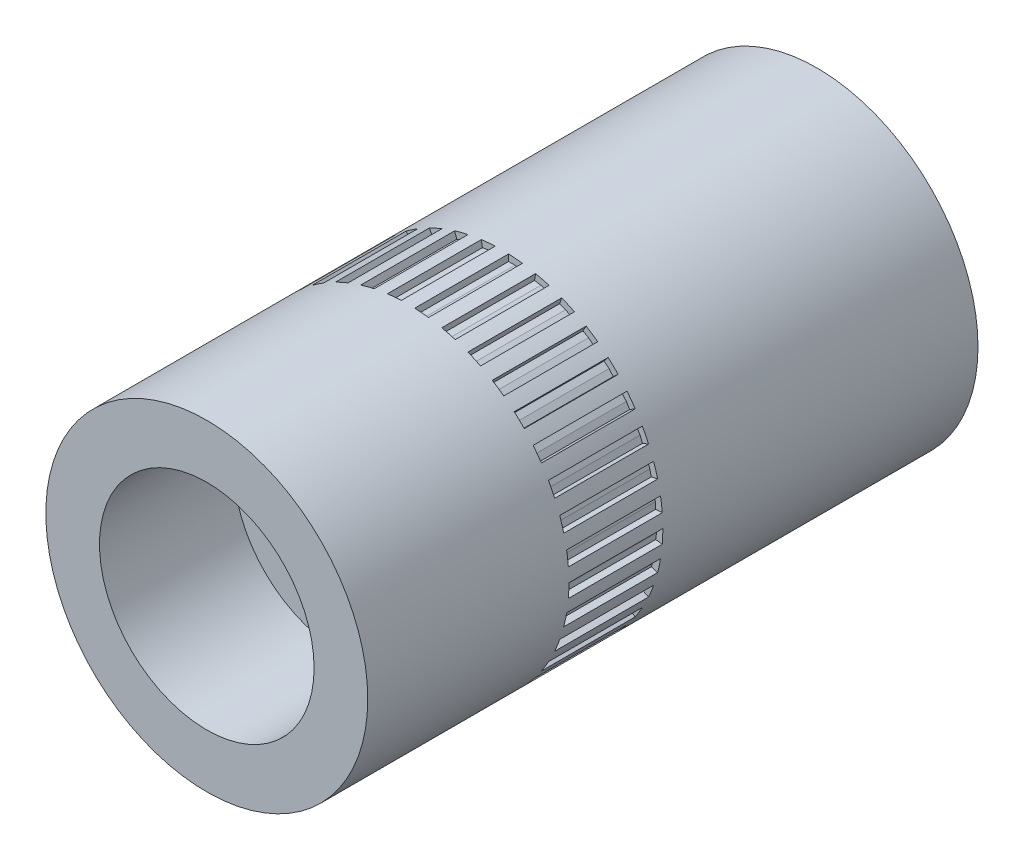
from build123d import *

# Parameters (mm, degrees)
IZIM1_R                     = 11
IZIM1_R_2                   = 9.1
Y_KSEKLIK_EKSTR_ZYON1_DEPTH = 26.5
Y_KSEKLIK_EKSTR_ZYON2_START = -30.5
IZIM2_R                     = 12
IZIM2_R_2                   = 11
Y_KSEKLIK_EKSTR_ZYON2_DEPTH = 30.5
KES_EKSTR_ZYON1_START       = -7
KES_EKSTR_ZYON1_DEPTH       = 7
IZIM4_R                     = 12
Y_KSEKLIK_EKSTR_ZYON3_DEPTH = 5
IZIM5_R                     = 12
IZIM5_R_2                   = 8
Y_KSEKLIK_EKSTR_ZYON4_DEPTH = 10


with BuildPart() as part:
    # Çizim1 → Yükseklik-Ekstrüzyon1 (new body)
    with BuildSketch(Plane.XY):
        Circle(IZIM1_R)
        Circle(IZIM1_R_2, mode=Mode.SUBTRACT)
    extrude(amount=Y_KSEKLIK_EKSTR_ZYON1_DEPTH)

    # Çizim2 → Yükseklik-Ekstrüzyon2 (add)
    with BuildSketch(Plane.XY.offset(26.5).offset(Y_KSEKLIK_EKSTR_ZYON2_START)):
        Circle(IZIM2_R)
        Circle(IZIM2_R_2, mode=Mode.SUBTRACT)
    extrude(amount=Y_KSEKLIK_EKSTR_ZYON2_DEPTH)

    # Çizim3 → Kes-Ekstrüzyon1 (cut)
    with BuildSketch(Plane.XY.offset(26.5).offset(KES_EKSTR_ZYON1_START)):
        with BuildLine():
            Line((-0.50016, 11.5), (-0.50016, 11.989572135))
            ThreePointArc((-0.50016, 11.989572135), (-1.017671094, 11.956769863), (-1.533281872, 11.901640505))
            Line((-1.533281872, 11.901640505), (-1.45054378, 11.419110419))
            Line((-1.45054378, 11.419110419), (-0.978794249, 11.5))
            Line((-0.978794249, 11.5), (-0.50016, 11.5))
        make_face()
        with BuildLine():
            ThreePointArc((1.533281872, 11.901640505), (1.017671094, 11.956769863), (0.50016, 11.989572135))
            Line((0.50016, 11.989572135), (0.50016, 11.5))
            Line((0.50016, 11.5), (0.978794249, 11.5))
            Line((0.978794249, 11.5), (1.45054378, 11.419110419))
            Line((1.45054378, 11.419110419), (1.533281872, 11.901640505))
        make_face()
        with BuildLine():
            Line((-2.436475087, 11.250055519), (-2.51921318, 11.732585604))
            ThreePointArc((-2.51921318, 11.732585604), (-3.023736737, 11.612795363), (-3.522614017, 11.471320346))
            Line((-3.522614017, 11.471320346), (-3.359518056, 11.009713823))
            Line((-3.359518056, 11.009713823), (-2.908224618, 11.169165938))
            Line((-2.908224618, 11.169165938), (-2.436475087, 11.250055519))
        make_face()
        with BuildLine():
            ThreePointArc((3.522614017, 11.471320346), (3.023736737, 11.612795363), (2.51921318, 11.732585604))
            Line((2.51921318, 11.732585604), (2.436475087, 11.250055519))
            Line((2.436475087, 11.250055519), (2.908224618, 11.169165938))
            Line((2.908224618, 11.169165938), (3.359518056, 11.009713823))
            Line((3.359518056, 11.009713823), (3.522614017, 11.471320346))
        make_face()
        with BuildLine():
            Line((-4.302697223, 10.676467423), (-4.465793183, 11.138073947))
            ThreePointArc((-4.465793183, 11.138073947), (-4.942814979, 10.934741885), (-5.41060697, 10.710991187))
            Line((-5.41060697, 10.710991187), (-5.171845115, 10.283587804))
            Line((-5.171845115, 10.283587804), (-4.753990661, 10.517015308))
            Line((-4.753990661, 10.517015308), (-4.302697223, 10.676467423))
        make_face()
        with BuildLine():
            ThreePointArc((5.41060697, 10.710991187), (4.942814979, 10.934741885), (4.465793183, 11.138073947))
            Line((4.465793183, 11.138073947), (4.302697223, 10.676467423))
            Line((4.302697223, 10.676467423), (4.753990661, 10.517015308))
            Line((4.753990661, 10.517015308), (5.171845115, 10.283587804))
            Line((5.171845115, 10.283587804), (5.41060697, 10.710991187))
        make_face()
        with BuildLine():
            Line((-6.045138593, 9.795736798), (-6.283900447, 10.223140181))
            ThreePointArc((-6.283900447, 10.223140181), (-6.719697434, 9.942115791), (-7.142946611, 9.642526314))
            Line((-7.142946611, 9.642526314), (-6.835387606, 9.261621689))
            Line((-6.835387606, 9.261621689), (-6.462993047, 9.562309295))
            Line((-6.462993047, 9.562309295), (-6.045138593, 9.795736798))
        make_face()
        with BuildLine():
            ThreePointArc((7.142946611, 9.642526314), (6.719697434, 9.942115791), (6.283900447, 10.223140181))
            Line((6.283900447, 10.223140181), (6.045138593, 9.795736798))
            Line((6.045138593, 9.795736798), (6.462993047, 9.562309295))
            Line((6.462993047, 9.562309295), (6.835387606, 9.261621689))
            Line((6.835387606, 9.261621689), (7.142946611, 9.642526314))
        make_face()
        with BuildLine():
            Line((-7.613672332, 8.633200661), (-7.921231337, 9.014105286))
            ThreePointArc((-7.921231337, 9.014105286), (-8.303266428, 8.663473127), (-8.669796684, 8.296663514))
            Line((-8.669796684, 8.296663514), (-8.302288441, 7.973215579))
            Line((-8.302288441, 7.973215579), (-7.986066891, 8.332513054))
            Line((-7.986066891, 8.332513054), (-7.613672332, 8.633200661))
        make_face()
        with BuildLine():
            ThreePointArc((8.669796684, 8.296663514), (8.303266428, 8.663473127), (7.921231337, 9.014105286))
            Line((7.921231337, 9.014105286), (7.613672332, 8.633200661))
            Line((7.613672332, 8.633200661), (7.986066891, 8.332513054))
            Line((7.986066891, 8.332513054), (8.302288441, 7.973215579))
            Line((8.302288441, 7.973215579), (8.669796684, 8.296663514))
        make_face()
        with BuildLine():
            Line((-8.96317458, 7.222303059), (-9.330682823, 7.545750993))
            ThreePointArc((-9.330682823, 7.545750993), (-9.647965564, 7.135598116), (-9.947232491, 6.712120811))
            Line((-9.947232491, 6.712120811), (-9.530347553, 6.455434574))
            Line((-9.530347553, 6.455434574), (-9.27939613, 6.863005584))
            Line((-9.27939613, 6.863005584), (-8.96317458, 7.222303059))
        make_face()
        with BuildLine():
            ThreePointArc((9.947232491, 6.712120811), (9.647965564, 7.135598116), (9.330682823, 7.545750993))
            Line((9.330682823, 7.545750993), (8.96317458, 7.222303059))
            Line((8.96317458, 7.222303059), (9.27939613, 6.863005584))
            Line((9.27939613, 6.863005584), (9.530347553, 6.455434574))
            Line((9.530347553, 6.455434574), (9.947232491, 6.712120811))
        make_face()
        with BuildLine():
            Line((-10.054822615, 5.603632947), (-10.471707553, 5.860319183))
            ThreePointArc((-10.471707553, 5.860319183), (-10.715110298, 5.402444938), (-10.93850453, 4.934482612))
            Line((-10.93850453, 4.934482612), (-10.484235918, 4.75194247))
            Line((-10.484235918, 4.75194247), (-10.305774038, 5.196061938))
            Line((-10.305774038, 5.196061938), (-10.054822615, 5.603632947))
        make_face()
        with BuildLine():
            ThreePointArc((10.93850453, 4.934482612), (10.715110298, 5.402444938), (10.471707553, 5.860319183))
            Line((10.471707553, 5.860319183), (10.054822615, 5.603632947))
            Line((10.054822615, 5.603632947), (10.305774038, 5.196061938))
            Line((10.305774038, 5.196061938), (10.484235918, 4.75194247))
            Line((10.484235918, 4.75194247), (10.93850453, 4.934482612))
        make_face()
        with BuildLine():
            Line((-10.85721171, 3.823756519), (-11.311480322, 4.00629666))
            ThreePointArc((-11.311480322, 4.00629666), (-11.474000817, 3.513873255), (-11.615095709, 3.014888333))
            Line((-11.615095709, 3.014888333), (-11.136511904, 2.911745633))
            Line((-11.136511904, 2.911745633), (-11.03567359, 3.379637051))
            Line((-11.03567359, 3.379637051), (-10.85721171, 3.823756519))
        make_face()
        with BuildLine():
            ThreePointArc((11.615095709, 3.014888333), (11.474000817, 3.513873255), (11.311480322, 4.00629666))
            Line((11.311480322, 4.00629666), (10.85721171, 3.823756519))
            Line((10.85721171, 3.823756519), (11.03567359, 3.379637051))
            Line((11.03567359, 3.379637051), (11.136511904, 2.911745633))
            Line((11.136511904, 2.911745633), (11.615095709, 3.014888333))
        make_face()
        with BuildLine():
            Line((-11.347258592, 1.933877577), (-11.825842397, 2.037020277))
            ThreePointArc((-11.825842397, 2.037020277), (-11.902805223, 1.524213837), (-11.957541733, 1.008561206))
            Line((-11.957541733, 1.008561206), (-11.468410719, 0.987783176))
            Line((-11.468410719, 0.987783176), (-11.448096906, 1.465986159))
            Line((-11.448096906, 1.465986159), (-11.347258592, 1.933877577))
        make_face()
        with BuildLine():
            ThreePointArc((11.957541733, 1.008561206), (11.902805223, 1.524213837), (11.825842397, 2.037020277))
            Line((11.825842397, 2.037020277), (11.347258592, 1.933877577))
            Line((11.347258592, 1.933877577), (11.448096906, 1.465986159))
            Line((11.448096906, 1.465986159), (11.468410719, 0.987783176))
            Line((11.468410719, 0.987783176), (11.957541733, 1.008561206))
        make_face()
        with BuildLine():
            Line((-11.510865504, -0.011635502), (-11.999996517, 0.009142528))
            ThreePointArc((-11.999996517, 0.009142528), (-11.989187594, -0.509294438), (-11.955991052, -1.026780391))
            Line((-11.955991052, -1.026780391), (-11.470384238, -0.964596005))
            Line((-11.470384238, -0.964596005), (-11.531179317, -0.489838486))
            Line((-11.531179317, -0.489838486), (-11.510865504, -0.011635502))
        make_face()
        with BuildLine():
            ThreePointArc((11.955991052, -1.026780391), (11.989187594, -0.509294438), (11.999996517, 0.009142528))
            Line((11.999996517, 0.009142528), (11.510865504, -0.011635502))
            Line((11.510865504, -0.011635502), (11.531179317, -0.489838486))
            Line((11.531179317, -0.489838486), (11.470384238, -0.964596005))
            Line((11.470384238, -0.964596005), (11.955991052, -1.026780391))
        make_face()
        with BuildLine():
            Line((-11.343325773, -1.956813849), (-11.828932586, -2.018998234))
            ThreePointArc((-11.828932586, -2.018998234), (-11.730662867, -2.52815124), (-11.610488276, -3.032583385))
            Line((-11.610488276, -3.032583385), (-11.142375687, -2.889225516))
            Line((-11.142375687, -2.889225516), (-11.282530694, -2.431571369))
            Line((-11.282530694, -2.431571369), (-11.343325773, -1.956813849))
        make_face()
        with BuildLine():
            ThreePointArc((11.610488276, -3.032583385), (11.730662867, -2.52815124), (11.828932586, -2.018998234))
            Line((11.828932586, -2.018998234), (11.343325773, -1.956813849))
            Line((11.343325773, -1.956813849), (11.282530694, -2.431571369))
            Line((11.282530694, -2.431571369), (11.142375687, -2.889225516))
            Line((11.142375687, -2.889225516), (11.610488276, -3.032583385))
        make_face()
        with BuildLine():
            Line((-10.849459212, -3.845698224), (-11.317571802, -3.989056093))
            ThreePointArc((-11.317571802, -3.989056093), (-11.134668328, -4.474277733), (-10.930972892, -4.951144477))
            Line((-10.930972892, -4.951144477), (-10.493821274, -4.730737268))
            Line((-10.493821274, -4.730737268), (-10.709304205, -4.303352371))
            Line((-10.709304205, -4.303352371), (-10.849459212, -3.845698224))
        make_face()
        with BuildLine():
            ThreePointArc((10.930972892, -4.951144477), (11.134668328, -4.474277733), (11.317571802, -3.989056093))
            Line((11.317571802, -3.989056093), (10.849459212, -3.845698224))
            Line((10.849459212, -3.845698224), (10.709304205, -4.303352371))
            Line((10.709304205, -4.303352371), (10.493821274, -4.730737268))
            Line((10.493821274, -4.730737268), (10.930972892, -4.951144477))
        make_face()
        with BuildLine():
            Line((-10.043473464, -5.623948863), (-10.480625082, -5.844356071))
            ThreePointArc((-10.480625082, -5.844356071), (-10.218349653, -6.291687403), (-9.93699332, -6.727270156))
            Line((-9.93699332, -6.727270156), (-9.543378729, -6.436154323))
            Line((-9.543378729, -6.436154323), (-9.827990532, -6.05133376))
            Line((-9.827990532, -6.05133376), (-10.043473464, -5.623948863))
        make_face()
        with BuildLine():
            ThreePointArc((9.93699332, -6.727270156), (10.218349653, -6.291687403), (10.480625082, -5.844356071))
            Line((10.480625082, -5.844356071), (10.043473464, -5.623948863))
            Line((10.043473464, -5.623948863), (9.827990532, -6.05133376))
            Line((9.827990532, -6.05133376), (9.543378729, -6.436154323))
            Line((9.543378729, -6.436154323), (9.93699332, -6.727270156))
        make_face()
        with BuildLine():
            Line((-8.94855527, -7.240408732), (-9.342169861, -7.531524566))
            ThreePointArc((-9.342169861, -7.531524566), (-9.008067663, -7.928096681), (-8.657144542, -8.309864522))
            Line((-8.657144542, -8.309864522), (-8.318390553, -7.956414936))
            Line((-8.318390553, -7.956414936), (-8.663943466, -7.625229295))
            Line((-8.663943466, -7.625229295), (-8.94855527, -7.240408732))
        make_face()
        with BuildLine():
            ThreePointArc((8.657144542, -8.309864522), (9.008067663, -7.928096681), (9.342169861, -7.531524566))
            Line((9.342169861, -7.531524566), (8.94855527, -7.240408732))
            Line((8.94855527, -7.240408732), (8.663943466, -7.625229295))
            Line((8.663943466, -7.625229295), (8.318390553, -7.956414936))
            Line((8.318390553, -7.956414936), (8.657144542, -8.309864522))
        make_face()
        with BuildLine():
            Line((-7.596203433, -8.648575225), (-7.934957422, -9.002024811))
            ThreePointArc((-7.934957422, -9.002024811), (-7.538639968, -9.336429052), (-7.128245478, -9.653399215))
            Line((-7.128245478, -9.653399215), (-6.854097427, -9.247783977))
            Line((-6.854097427, -9.247783977), (-7.25065052, -8.979760866))
            Line((-7.25065052, -8.979760866), (-7.596203433, -8.648575225))
        make_face()
        with BuildLine():
            ThreePointArc((7.128245478, -9.653399215), (7.538639968, -9.336429052), (7.934957422, -9.002024811))
            Line((7.934957422, -9.002024811), (7.596203433, -8.648575225))
            Line((7.596203433, -8.648575225), (7.25065052, -8.979760866))
            Line((7.25065052, -8.979760866), (6.854097427, -9.247783977))
            Line((6.854097427, -9.247783977), (7.128245478, -9.653399215))
        make_face()
        with BuildLine():
            Line((-6.025322654, -9.807937955), (-6.299470706, -10.213553193))
            ThreePointArc((-6.299470706, -10.213553193), (-5.852339326, -10.476169358), (-5.39427977, -10.719223188))
            Line((-5.39427977, -10.719223188), (-5.192624397, -10.273111111))
            Line((-5.192624397, -10.273111111), (-5.628769561, -10.075961067))
            Line((-5.628769561, -10.075961067), (-6.025322654, -9.807937955))
        make_face()
        with BuildLine():
            ThreePointArc((5.39427977, -10.719223188), (5.852339326, -10.476169358), (6.299470706, -10.213553193))
            Line((6.299470706, -10.213553193), (6.025322654, -9.807937955))
            Line((6.025322654, -9.807937955), (5.628769561, -10.075961067))
            Line((5.628769561, -10.075961067), (5.192624397, -10.273111111))
            Line((5.192624397, -10.273111111), (5.39427977, -10.719223188))
        make_face()
        with BuildLine():
            Line((-4.281104313, -10.685144168), (-4.482759686, -11.131256245))
            ThreePointArc((-4.482759686, -11.131256245), (-3.997677537, -11.314529346), (-3.505130454, -11.476674627))
            Line((-3.505130454, -11.476674627), (-3.381769017, -11.002899543))
            Line((-3.381769017, -11.002899543), (-3.844959149, -10.882294212))
            Line((-3.844959149, -10.882294212), (-4.281104313, -10.685144168))
        make_face()
        with BuildLine():
            ThreePointArc((3.505130454, -11.476674627), (3.997677537, -11.314529346), (4.482759686, -11.131256245))
            Line((4.482759686, -11.131256245), (4.281104313, -10.685144168))
            Line((4.281104313, -10.685144168), (3.844959149, -10.882294212))
            Line((3.844959149, -10.882294212), (3.381769017, -11.002899543))
            Line((3.381769017, -11.002899543), (3.505130454, -11.476674627))
        make_face()
        with BuildLine():
            Line((-2.413726395, -11.254958237), (-2.537087833, -11.728733322))
            ThreePointArc((-2.537087833, -11.728733322), (-2.028009844, -11.827390924), (-1.515144917, -11.903963033))
            Line((-1.515144917, -11.903963033), (-1.473626299, -11.416154587))
            Line((-1.473626299, -11.416154587), (-1.950536263, -11.375563567))
            Line((-1.950536263, -11.375563567), (-2.413726395, -11.254958237))
        make_face()
        with BuildLine():
            ThreePointArc((1.515144917, -11.903963033), (2.028009844, -11.827390924), (2.537087833, -11.728733322))
            Line((2.537087833, -11.728733322), (2.413726395, -11.254958237))
            Line((2.413726395, -11.254958237), (1.950536263, -11.375563567))
            Line((1.950536263, -11.375563567), (1.473626299, -11.416154587))
            Line((1.473626299, -11.416154587), (1.515144917, -11.903963033))
        make_face()
        with BuildLine():
            Line((-0.476909964, -11.500987649), (-0.518428581, -11.988796095))
            ThreePointArc((-0.518428581, -11.988796095), (0, -12), (0.518428581, -11.988796095))
            Line((0.518428581, -11.988796095), (0.476909964, -11.500987649))
            Line((0.476909964, -11.500987649), (0, -11.541578669))
            Line((0, -11.541578669), (-0.476909964, -11.500987649))
        make_face()
    extrude(amount=KES_EKSTR_ZYON1_DEPTH, mode=Mode.SUBTRACT)

    # Çizim4 → Yükseklik-Ekstrüzyon3 (add)
    with BuildSketch(Plane.XY.offset(26.5)):
        Circle(IZIM4_R)
    extrude(amount=Y_KSEKLIK_EKSTR_ZYON3_DEPTH)

    # Çizim5 → Yükseklik-Ekstrüzyon4 (add)
    with BuildSketch(Plane.XY.offset(31.5)):
        Circle(IZIM5_R)
        Circle(IZIM5_R_2, mode=Mode.SUBTRACT)
    extrude(amount=Y_KSEKLIK_EKSTR_ZYON4_DEPTH)


solid = part.part
